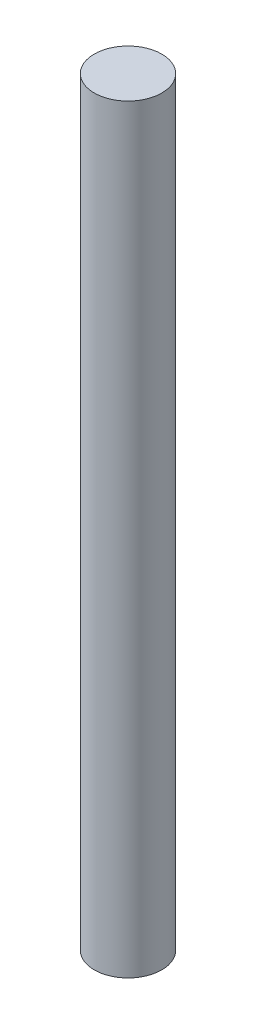
from build123d import *

# Parameters (mm, degrees)
SKETCH1_R           = 2
BOSS_EXTRUDE1_DEPTH = 45


with BuildPart() as part:
    # Sketch1 → Boss-Extrude1 (new body)
    with BuildSketch(Plane(origin=(0, 0, 0), x_dir=(1, 0, 0), z_dir=(0, 1, 0))):
        with Locations(Location((0, 0, 0), (0, 0, 90))):
            Circle(SKETCH1_R)
    extrude(amount=BOSS_EXTRUDE1_DEPTH)


solid = part.part
